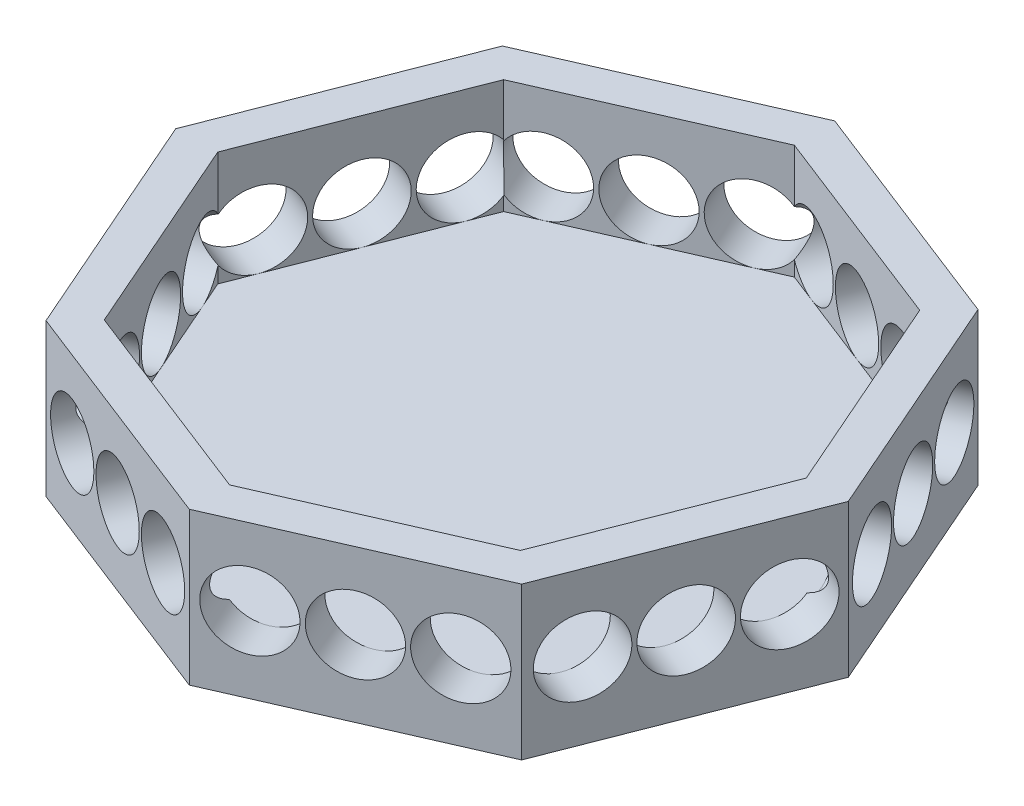
from build123d import *

# Parameters (mm, degrees)
BOSS_EXTRUDE1_DEPTH     = 127
SHELL2_T                = -31.75
SKETCH2_R               = 31.75
CUT_EXTRUDE1_DEPTH      = 643.020000528
SKETCH3_R               = 31.75
CUT_EXTRUDE2_DEPTH      = 645.43437317
SKETCH4_R               = 31.75
CUT_EXTRUDE3_DEPTH      = 643.020000528
CUT_EXTRUDE4_DEPTH      = 645.43437317
CUT_EXTRUDE4_DEPTH_BACK = 645.43437317
SKETCH5_R               = 31.75


with BuildPart() as part:
    # Sketch1 → Boss-Extrude1 (new body)
    with BuildSketch(Plane(origin=(0, 0, 0), x_dir=(1, 0, 0), z_dir=(0, 1, 0))):
        Polygon((198.258990648, -190.264676509), (274.727719698, 5.652833739), (190.264676509, 198.258990648), (-5.652833739, 274.727719698), (-198.258990648, 190.264676509), (-274.727719698, -5.652833739), (-190.264676509, -198.258990648), (5.652833739, -274.727719698), align=None)
    extrude(amount=BOSS_EXTRUDE1_DEPTH)

    # Shell2
    shell2_openings = [part.faces().sort_by_distance(p)[0] for p in [
        (0, 127, 0),
    ]]
    offset(amount=SHELL2_T, openings=shell2_openings, kind=Kind.INTERSECTION)

    # Sketch2 → Cut-Extrude1 (cut, through all)
    with BuildSketch(Plane(origin=(-92.305921385, 0, 236.493355173), x_dir=(0.9315564981895357, 0, 0.36359660433074675), z_dir=(-0.36359660433074675, 0, 0.9315564981895357))):
        with Locations((-66.675, 63.5)):
            Circle(SKETCH2_R)
        with Locations((0, 63.5)):
            Circle(SKETCH2_R)
        with Locations((66.675, 63.5)):
            Circle(SKETCH2_R)
    extrude(amount=-CUT_EXTRUDE1_DEPTH, mode=Mode.SUBTRACT)

    # Sketch3 → Cut-Extrude2 (cut, through all)
    with BuildSketch(Plane(origin=(101.955912193, 0, 232.496198103), x_dir=(0.9158115414668875, 0, -0.4016082923895416), z_dir=(0.4016082923895416, 0, 0.9158115414668875))):
        with Locations((-66.802, 63.5)):
            Circle(SKETCH3_R)
        with Locations((0, 63.5)):
            Circle(SKETCH3_R)
        with Locations((66.675, 63.5)):
            Circle(SKETCH3_R)
    extrude(amount=-CUT_EXTRUDE2_DEPTH, mode=Mode.SUBTRACT)

    # Sketch4 → Cut-Extrude3 (cut, through all)
    with BuildSketch(Plane(origin=(236.493355173, 0, 92.305921385), x_dir=(0.3635966043307465, 0, -0.9315564981895359), z_dir=(0.9315564981895358, 0, 0.3635966043307464))):
        with Locations((-65.869378977, 63.5)):
            Circle(SKETCH4_R)
        with Locations((0.805621023, 63.5)):
            Circle(SKETCH4_R)
        with Locations((67.480621023, 63.5)):
            Circle(SKETCH4_R)
    extrude(amount=-CUT_EXTRUDE3_DEPTH, mode=Mode.SUBTRACT)

    # Sketch5 → Cut-Extrude4 (cut, two sides: drawn at the far end of the back side and taken through both)
    with BuildSketch(Plane(origin=(232.496198103, 0, -101.955912193), x_dir=(-0.401608292389542, 0, -0.9158115414668874), z_dir=(0.9158115414668874, 0, -0.401608292389542)).offset(-CUT_EXTRUDE4_DEPTH_BACK)):
        with Locations(Location((-66.675, 63.5, 0), (0, 0, 180))):
            Circle(SKETCH5_R)
        with Locations((0, 63.5)):
            Circle(SKETCH5_R)
        with Locations((66.675, 63.5)):
            Circle(SKETCH5_R)
    extrude(amount=CUT_EXTRUDE4_DEPTH + CUT_EXTRUDE4_DEPTH_BACK, mode=Mode.SUBTRACT)


solid = part.part
